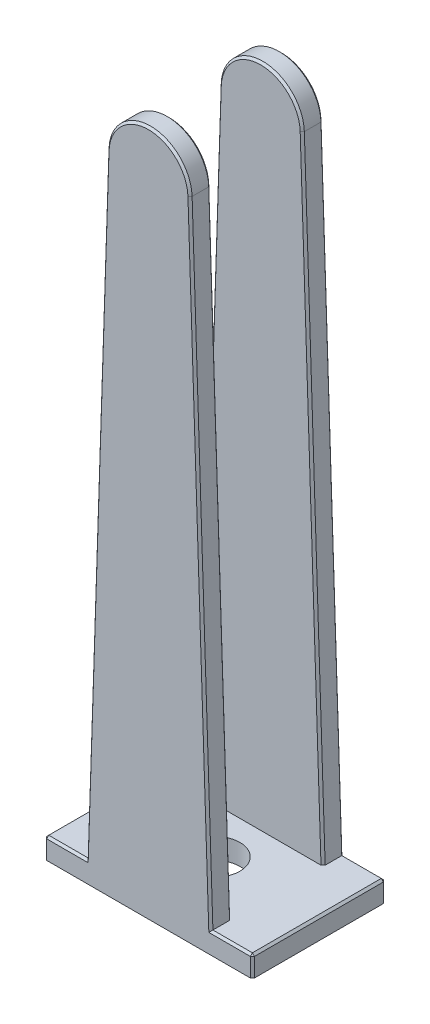
from build123d import *

# Parameters (mm, degrees)
BOSS_EXTRUDE2_DEPTH = 5
BOSS_EXTRUDE3_DEPTH = 5
SKETCH3_R           = 6
CUT_EXTRUDE1_DEPTH  = 173.768631412
CHAMFER1_SIZE       = 0.5


with BuildPart() as part:
    # Sketch2 → Boss-Extrude2 (new body)
    with BuildSketch(Plane(origin=(0, 0, 0), x_dir=(1, 0, 0), z_dir=(0, 1, 0))):
        Polygon((0, 0), (-40, 0), (-40, -16), (0, -16), (10, -16), (10, 0), align=None)
    extrude(amount=-BOSS_EXTRUDE2_DEPTH)

    # Sketch1 → Boss-Extrude3 (add)
    with BuildSketch(Plane.XY):
        with BuildLine():
            Line((0, 0), (-30, 0))
            Line((-30, 0), (-24.994461357, 150.332779469))
            ThreePointArc((-24.994461357, 150.332779469), (-15, 160), (-5.005538643, 150.332779469))
            Line((-5.005538643, 150.332779469), (0, 0))
        make_face()
    extrude(amount=BOSS_EXTRUDE3_DEPTH)

    # Mirror1: part across plane


with BuildPart() as part_1:
    add(part.part)
    add(part.part.mirror(Plane(origin=(10, -5, 16), x_dir=(1, 0, 0), z_dir=(0, 0, 1))))

    # Sketch3 → Cut-Extrude1 (cut, through all)
    with BuildSketch(Plane.XZ.offset(5)):
        with Locations(Location((-15, 16, 0), (0, 0, 270))):
            Circle(SKETCH3_R)
    extrude(amount=-CUT_EXTRUDE1_DEPTH, mode=Mode.SUBTRACT)

    # Chamfer1
    chamfer1_edges = [part_1.edges().sort_by_distance(p)[0] for p in [
        (10, -2.5, 0),
        (-40, -2.5, 0),
        (-35, 0, 0),
        (-2.502769321, 75.166389735, 0),
        (-15, 160, 0),
        (-27.497230679, 75.166389735, 0),
        (-2.502769321, 75.166389735, 5),
        (-15, 160, 5),
        (-27.497230679, 75.166389735, 5),
        (-40, -2.5, 32),
        (5, 0, 32),
        (-2.502769321, 75.166389735, 32),
        (-15, 160, 32),
        (-27.497230679, 75.166389735, 32),
        (-35, 0, 32),
        (10, -2.5, 32),
        (-2.502769321, 75.166389735, 27),
        (-15, 160, 27),
        (-27.497230679, 75.166389735, 27),
        (10, 0, 16),
        (-40, 0, 16),
        (5, 0, 0),
    ]]
    chamfer(chamfer1_edges, length=CHAMFER1_SIZE)


solid = part_1.part
